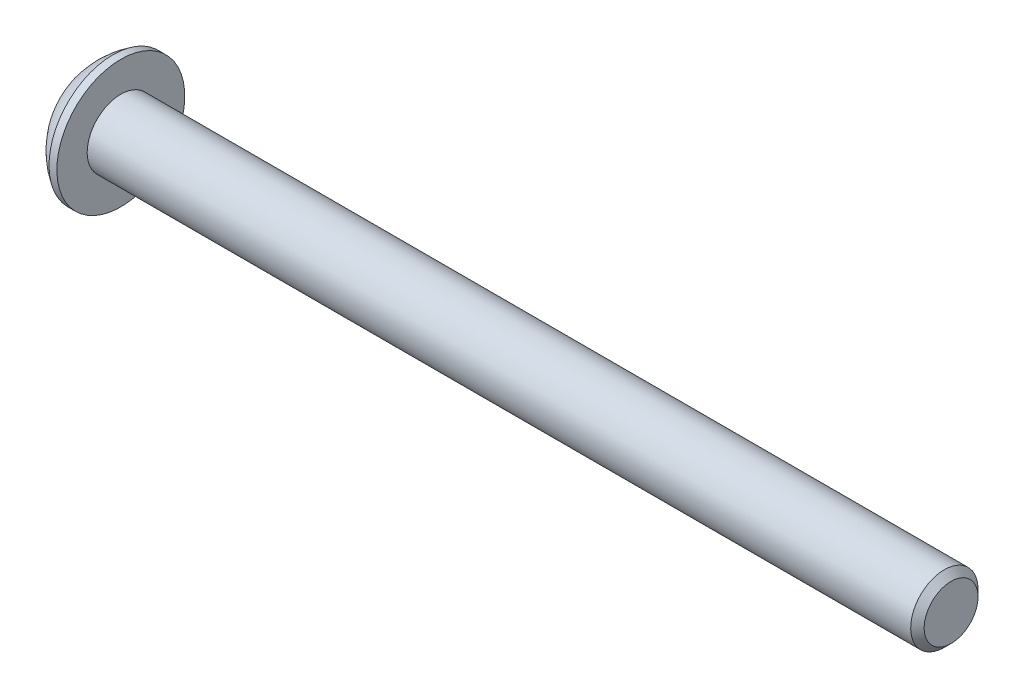
from build123d import *

# Parameters (mm, degrees)
CHAMFER1_SIZE      = 0.3
CUT_EXTRUDE1_DEPTH = 1


with BuildPart() as part:
    # Sketch2 → Revolve1 (revolve)
    with BuildSketch(Plane.XY):
        with BuildLine():
            Line((38.65, 0), (0, 0))
            Line((0, 0), (0, 1.43))
            ThreePointArc((0, 1.43), (0.550445176, 2.231141741), (1.3, 2.85))
            Line((1.3, 2.85), (1.65, 2.85))
            Line((1.65, 2.85), (1.65, 1.5))
            Line((1.65, 1.5), (38.65, 1.5))
            Line((38.65, 1.5), (38.65, 0))
        make_face()
    revolve(axis=Axis((38.65, 0, 0), (-1, 0, 0)))

    # Chamfer1
    chamfer1_edges = [part.edges().sort_by_distance(p)[0] for p in [
        (38.65, -1.5, 0),
    ]]
    chamfer(chamfer1_edges, length=CHAMFER1_SIZE)

    # Sketch3 → Cut-Extrude1 (cut)
    with BuildSketch(Plane.ZY):
        Polygon((1, -0.577350269), (1, 0.577350269), (0, 1.154700538), (-1, 0.577350269), (-1, -0.577350269), (0, -1.154700538), align=None)
    extrude(amount=-CUT_EXTRUDE1_DEPTH, mode=Mode.SUBTRACT)


solid = part.part
